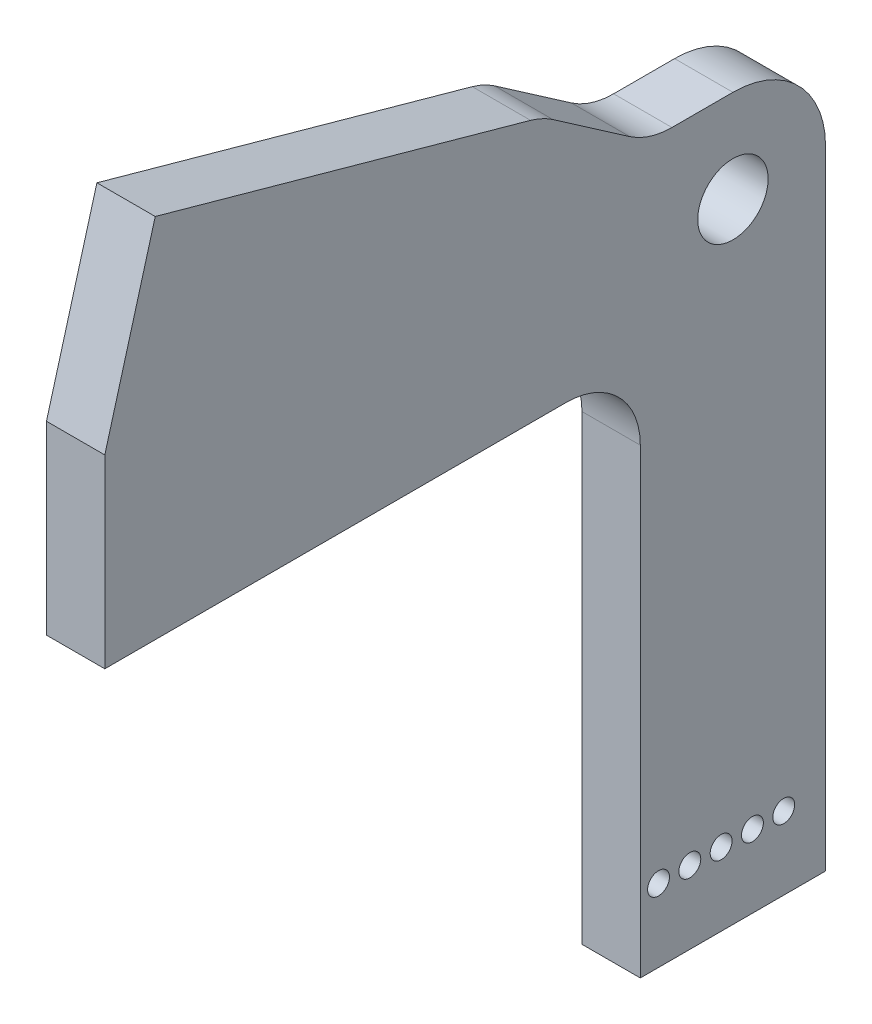
from build123d import *

# Parameters (mm, degrees)
SKETCH1_R           = 2.413
SKETCH1_R_2         = 0.75
BOSS_EXTRUDE1_DEPTH = 2


with BuildPart() as part:
    # Sketch1 → Boss-Extrude1 (new, symmetric)
    with BuildSketch(Plane(origin=(0, 0, 0), x_dir=(0, 0, -1), z_dir=(1, 0, 0))):
        with BuildLine():
            Line((-4.180666535, 6.35), (0, 6.35))
            ThreePointArc((0, 6.35), (4.490128061, 4.490128061), (6.35, 0))
            Line((6.35, 0), (6.35, -43.06614877))
            Line((6.35, -43.06614877), (-6.35, -43.06614877))
            Line((-6.35, -43.06614877), (-6.35, -11.43))
            ThreePointArc((-6.35, -11.43), (-7.837897552, -7.837897552), (-11.43, -6.35))
            Line((-11.43, -6.35), (-43.06614877, -6.35))
            Line((-43.06614877, -6.35), (-43.06614877, 6.35))
            Line((-43.06614877, 6.35), (-39.60826893, 18.780106665))
            Line((-39.60826893, 18.780106665), (-13.871980247, 11.620635214))
            ThreePointArc((-13.871980247, 11.620635214), (-13.07637114, 11.325756262), (-12.340940682, 10.902566601))
            Line((-12.340940682, 10.902566601), (-7.073190955, 7.253913018))
            ThreePointArc((-7.073190955, 7.253913018), (-5.695902182, 6.5812413), (-4.180666535, 6.35))
        make_face()
        Circle(SKETCH1_R, mode=Mode.SUBTRACT)
        with Locations((-5.1, -38.06614877)):
            Circle(SKETCH1_R_2, mode=Mode.SUBTRACT)
        with Locations((-2.954545455, -38.06614877)):
            Circle(SKETCH1_R_2, mode=Mode.SUBTRACT)
        with Locations((-0.809090909, -38.06614877)):
            Circle(SKETCH1_R_2, mode=Mode.SUBTRACT)
        with Locations((1.336363636, -38.06614877)):
            Circle(SKETCH1_R_2, mode=Mode.SUBTRACT)
        with Locations((3.481818182, -38.06614877)):
            Circle(SKETCH1_R_2, mode=Mode.SUBTRACT)
    extrude(amount=BOSS_EXTRUDE1_DEPTH, both=True)


solid = part.part
